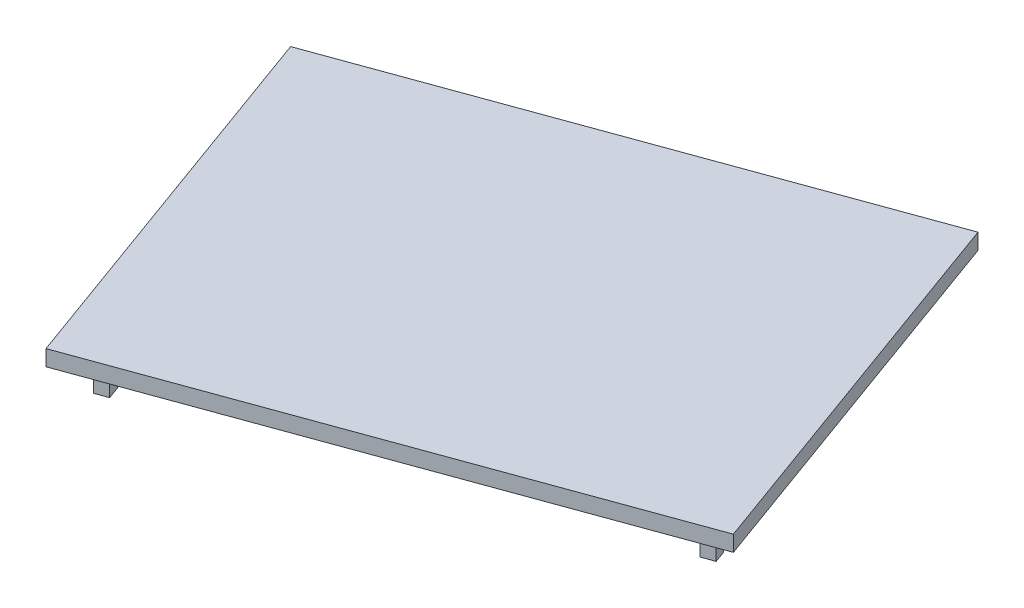
from build123d import *

# Parameters (mm, degrees)
EXTRUDE_1_DEPTH = 5
EXTRUDE_2_DEPTH = 10


with BuildPart() as part:
    # 草图2 → 凸台-拉伸1 (new body)
    with BuildSketch(Plane(origin=(0, 0, 0), x_dir=(1, 0, 0), z_dir=(0, 1, 0))):
        Polygon((-101.961949946, 31.82244298), (57.849497127, 89.790549593), (101.961949946, -31.82244298), (-57.849497127, -89.790549593), align=None)
    extrude(amount=EXTRUDE_1_DEPTH)

    # 草图3 → 凸台-拉伸2 (add)
    with BuildSketch(Plane(origin=(0, 0, 0), x_dir=(1, 0, 0), z_dir=(0, 1, 0))):
        Polygon((-53.056842775, -79.542085251), (-49.296573432, -78.178129801), (-50.760983059, -74.140919768), (-54.521252402, -75.504875218), align=None)
        Polygon((87.953231018, -28.393770643), (91.713500361, -27.029815193), (90.364794207, -23.311586416), (86.604524864, -24.675541865), align=None)
        Polygon((50.660555447, 74.417875215), (54.42082479, 75.781830665), (53.058052487, 79.538838208), (49.297783144, 78.174882759), align=None)
        Polygon((-90.349544911, 23.26954585), (-86.589275569, 24.6335013), (-87.969378224, 28.438286645), (-91.729647567, 27.074331195), align=None)
    extrude(amount=-EXTRUDE_2_DEPTH)


solid = part.part
